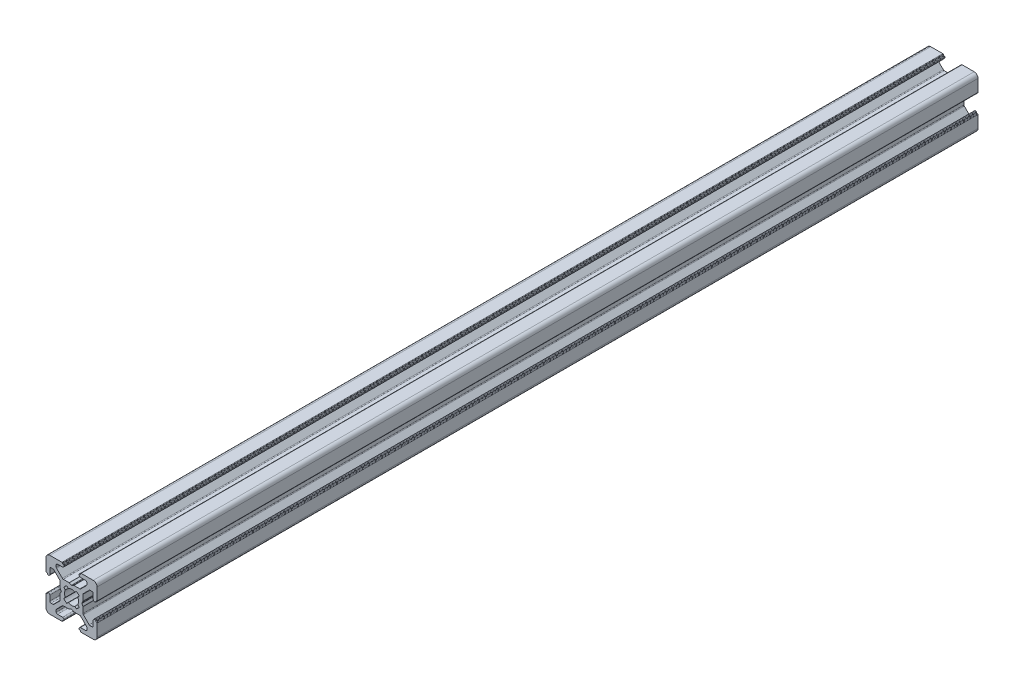
from build123d import *

# Parameters (mm, degrees)
EXTRUDE1_DEPTH = 345


with BuildPart() as part:
    # Sketch1 → Extrude1 (new body)
    with BuildSketch(Plane.XY):
        with BuildLine():
            Line((-3.5, 8.499999673), (-5.500000686, 8.499999673))
            ThreePointArc((-5.500000686, 8.499999673), (-5.853554077, 8.353553064), (-6.000000686, 7.999999673))
            Line((-6.000000686, 7.999999673), (-6.000000686, 7.267766626))
            ThreePointArc((-6.000000686, 7.267766626), (-5.961940448, 7.076424899), (-5.853554059, 6.914213219))
            Line((-5.853554059, 6.914213219), (-3.585787212, 4.646446592))
            ThreePointArc((-3.585787212, 4.646446592), (-3.423575544, 4.538060229), (-3.232233839, 4.5))
            Line((-3.232233839, 4.5), (-0.953590312, 4.5))
            ThreePointArc((-0.953590312, 4.5), (-0.901826505, 4.493185166), (-0.853590316, 4.473205083))
            Line((-0.853590316, 4.473205083), (-0.100000045, 4.038119562))
            ThreePointArc((-0.100000045, 4.038119562), (0, 4.011324632), (0.100000045, 4.038119562))
            Line((0.100000045, 4.038119562), (0.853590316, 4.473205083))
            ThreePointArc((0.853590316, 4.473205083), (0.901826505, 4.493185166), (0.953590312, 4.5))
            Line((0.953590312, 4.5), (3.232233839, 4.5))
            ThreePointArc((3.232233839, 4.5), (3.423575544, 4.538060229), (3.585787212, 4.646446592))
            Line((3.585787212, 4.646446592), (5.853554059, 6.914213219))
            ThreePointArc((5.853554059, 6.914213219), (5.961940448, 7.076424899), (6.000000686, 7.267766626))
            Line((6.000000686, 7.267766626), (6.000000686, 7.999999673))
            ThreePointArc((6.000000686, 7.999999673), (5.853554077, 8.353553064), (5.500000686, 8.499999673))
            Line((5.500000686, 8.499999673), (3.5, 8.499999673))
            ThreePointArc((3.5, 8.499999673), (3.146446609, 8.646446283), (3, 8.999999673))
            Line((3, 8.999999673), (3, 9.3))
            ThreePointArc((3, 9.3), (3.058578644, 9.441421356), (3.2, 9.5))
            Line((3.2, 9.5), (3.350000228, 9.5))
            ThreePointArc((3.350000228, 9.5), (3.491421584, 9.558578644), (3.550000228, 9.7))
            Line((3.550000228, 9.7), (3.550000228, 9.8))
            ThreePointArc((3.550000228, 9.8), (3.608578871, 9.941421356), (3.750000228, 10))
            Line((3.750000228, 10), (8.5, 10))
            ThreePointArc((8.5, 10), (9.560660172, 9.560660172), (10, 8.5))
            Line((10, 8.5), (10, 3.749999605))
            ThreePointArc((10, 3.749999605), (9.941421356, 3.608578248), (9.8, 3.549999605))
            Line((9.8, 3.549999605), (9.699999732, 3.549999605))
            ThreePointArc((9.699999732, 3.549999605), (9.558578376, 3.491420961), (9.499999732, 3.349999605))
            Line((9.499999732, 3.349999605), (9.499999732, 3.2))
            ThreePointArc((9.499999732, 3.2), (9.441421088, 3.058578644), (9.299999732, 3))
            Line((9.299999732, 3), (8.999999732, 3))
            ThreePointArc((8.999999732, 3), (8.646446341, 3.146446609), (8.499999732, 3.5))
            Line((8.499999732, 3.5), (8.499999732, 5.499999605))
            ThreePointArc((8.499999732, 5.499999605), (8.353553123, 5.853552995), (7.999999732, 5.999999605))
            Line((7.999999732, 5.999999605), (7.267766685, 5.999999605))
            ThreePointArc((7.267766685, 5.999999605), (7.076424969, 5.961939371), (6.914213294, 5.853552995))
            Line((6.914213294, 5.853552995), (4.646446398, 3.585786099))
            ThreePointArc((4.646446398, 3.585786099), (4.538060023, 3.423574425), (4.499999789, 3.232232708))
            Line((4.499999789, 3.232232708), (4.499999789, 0.953589302))
            ThreePointArc((4.499999789, 0.953589302), (4.493184953, 0.90182549), (4.473204867, 0.853589297))
            Line((4.473204867, 0.853589297), (4.038119841, 0.099999969))
            ThreePointArc((4.038119841, 0.099999969), (4.011324929, 0), (4.038119841, -0.099999969))
            Line((4.038119841, -0.099999969), (4.473204867, -0.853589297))
            ThreePointArc((4.473204867, -0.853589297), (4.493184953, -0.90182549), (4.499999789, -0.953589302))
            Line((4.499999789, -0.953589302), (4.499999789, -3.232232708))
            ThreePointArc((4.499999789, -3.232232708), (4.538060023, -3.423574425), (4.646446398, -3.585786099))
            Line((4.646446398, -3.585786099), (6.914213294, -5.853552995))
            ThreePointArc((6.914213294, -5.853552995), (7.076424969, -5.961939371), (7.267766685, -5.999999605))
            Line((7.267766685, -5.999999605), (7.999999732, -5.999999605))
            ThreePointArc((7.999999732, -5.999999605), (8.353553123, -5.853552995), (8.499999732, -5.499999605))
            Line((8.499999732, -5.499999605), (8.499999732, -3.5))
            ThreePointArc((8.499999732, -3.5), (8.646446341, -3.146446609), (8.999999732, -3))
            Line((8.999999732, -3), (9.299999732, -3))
            ThreePointArc((9.299999732, -3), (9.441421088, -3.058578644), (9.499999732, -3.2))
            Line((9.499999732, -3.2), (9.499999732, -3.349999605))
            ThreePointArc((9.499999732, -3.349999605), (9.558578376, -3.491420961), (9.699999732, -3.549999605))
            Line((9.699999732, -3.549999605), (9.8, -3.549999605))
            ThreePointArc((9.8, -3.549999605), (9.941421356, -3.608578248), (10, -3.749999605))
            Line((10, -3.749999605), (10, -8.5))
            ThreePointArc((10, -8.5), (9.560660172, -9.560660172), (8.5, -10))
            Line((8.5, -10), (3.750000228, -10))
            ThreePointArc((3.750000228, -10), (3.608578871, -9.941421356), (3.550000228, -9.8))
            Line((3.550000228, -9.8), (3.550000228, -9.7))
            ThreePointArc((3.550000228, -9.7), (3.491421584, -9.558578644), (3.350000228, -9.5))
            Line((3.350000228, -9.5), (3.2, -9.5))
            ThreePointArc((3.2, -9.5), (3.058578644, -9.441421356), (3, -9.3))
            Line((3, -9.3), (3, -8.999999673))
            ThreePointArc((3, -8.999999673), (3.146446609, -8.646446283), (3.5, -8.499999673))
            Line((3.5, -8.499999673), (5.500000686, -8.499999673))
            ThreePointArc((5.500000686, -8.499999673), (5.853554077, -8.353553064), (6.000000686, -7.999999673))
            Line((6.000000686, -7.999999673), (6.000000686, -7.267766626))
            ThreePointArc((6.000000686, -7.267766626), (5.961940448, -7.076424899), (5.853554059, -6.914213219))
            Line((5.853554059, -6.914213219), (3.585787212, -4.646446592))
            ThreePointArc((3.585787212, -4.646446592), (3.423575544, -4.538060229), (3.232233839, -4.5))
            Line((3.232233839, -4.5), (0.953590312, -4.5))
            ThreePointArc((0.953590312, -4.5), (0.901826505, -4.493185166), (0.853590316, -4.473205083))
            Line((0.853590316, -4.473205083), (0.100000045, -4.038119562))
            ThreePointArc((0.100000045, -4.038119562), (0, -4.011324632), (-0.100000045, -4.038119562))
            Line((-0.100000045, -4.038119562), (-0.853590316, -4.473205083))
            ThreePointArc((-0.853590316, -4.473205083), (-0.901826505, -4.493185166), (-0.953590312, -4.5))
            Line((-0.953590312, -4.5), (-3.232233839, -4.5))
            ThreePointArc((-3.232233839, -4.5), (-3.423575544, -4.538060229), (-3.585787212, -4.646446592))
            Line((-3.585787212, -4.646446592), (-5.853554059, -6.914213219))
            ThreePointArc((-5.853554059, -6.914213219), (-5.961940448, -7.076424899), (-6.000000686, -7.267766626))
            Line((-6.000000686, -7.267766626), (-6.000000686, -7.999999673))
            ThreePointArc((-6.000000686, -7.999999673), (-5.853554077, -8.353553064), (-5.500000686, -8.499999673))
            Line((-5.500000686, -8.499999673), (-3.5, -8.499999673))
            ThreePointArc((-3.5, -8.499999673), (-3.146446609, -8.646446283), (-3, -8.999999673))
            Line((-3, -8.999999673), (-3, -9.3))
            ThreePointArc((-3, -9.3), (-3.058578644, -9.441421356), (-3.2, -9.5))
            Line((-3.2, -9.5), (-3.350000228, -9.5))
            ThreePointArc((-3.350000228, -9.5), (-3.491421584, -9.558578644), (-3.550000228, -9.7))
            Line((-3.550000228, -9.7), (-3.550000228, -9.8))
            ThreePointArc((-3.550000228, -9.8), (-3.608578871, -9.941421356), (-3.750000228, -10))
            Line((-3.750000228, -10), (-8.5, -10))
            ThreePointArc((-8.5, -10), (-9.560660172, -9.560660172), (-10, -8.5))
            Line((-10, -8.5), (-10, -3.749999605))
            ThreePointArc((-10, -3.749999605), (-9.941421356, -3.608578248), (-9.8, -3.549999605))
            Line((-9.8, -3.549999605), (-9.699999732, -3.549999605))
            ThreePointArc((-9.699999732, -3.549999605), (-9.558578376, -3.491420961), (-9.499999732, -3.349999605))
            Line((-9.499999732, -3.349999605), (-9.499999732, -3.2))
            ThreePointArc((-9.499999732, -3.2), (-9.441421088, -3.058578644), (-9.299999732, -3))
            Line((-9.299999732, -3), (-8.999999732, -3))
            ThreePointArc((-8.999999732, -3), (-8.646446341, -3.146446609), (-8.499999732, -3.5))
            Line((-8.499999732, -3.5), (-8.499999732, -5.499999605))
            ThreePointArc((-8.499999732, -5.499999605), (-8.353553123, -5.853552995), (-7.999999732, -5.999999605))
            Line((-7.999999732, -5.999999605), (-7.267766685, -5.999999605))
            ThreePointArc((-7.267766685, -5.999999605), (-7.076424969, -5.961939371), (-6.914213294, -5.853552995))
            Line((-6.914213294, -5.853552995), (-4.646446398, -3.585786099))
            ThreePointArc((-4.646446398, -3.585786099), (-4.538060023, -3.423574425), (-4.499999789, -3.232232708))
            Line((-4.499999789, -3.232232708), (-4.499999789, -0.953589302))
            ThreePointArc((-4.499999789, -0.953589302), (-4.493184953, -0.90182549), (-4.473204867, -0.853589297))
            Line((-4.473204867, -0.853589297), (-4.038119841, -0.099999969))
            ThreePointArc((-4.038119841, -0.099999969), (-4.011324929, 0), (-4.038119841, 0.099999969))
            Line((-4.038119841, 0.099999969), (-4.473204867, 0.853589297))
            ThreePointArc((-4.473204867, 0.853589297), (-4.493184953, 0.90182549), (-4.499999789, 0.953589302))
            Line((-4.499999789, 0.953589302), (-4.499999789, 3.232232708))
            ThreePointArc((-4.499999789, 3.232232708), (-4.538060023, 3.423574425), (-4.646446398, 3.585786099))
            Line((-4.646446398, 3.585786099), (-6.914213294, 5.853552995))
            ThreePointArc((-6.914213294, 5.853552995), (-7.076424969, 5.961939371), (-7.267766685, 5.999999605))
            Line((-7.267766685, 5.999999605), (-7.999999732, 5.999999605))
            ThreePointArc((-7.999999732, 5.999999605), (-8.353553123, 5.853552995), (-8.499999732, 5.499999605))
            Line((-8.499999732, 5.499999605), (-8.499999732, 3.5))
            ThreePointArc((-8.499999732, 3.5), (-8.646446341, 3.146446609), (-8.999999732, 3))
            Line((-8.999999732, 3), (-9.299999732, 3))
            ThreePointArc((-9.299999732, 3), (-9.441421088, 3.058578644), (-9.499999732, 3.2))
            Line((-9.499999732, 3.2), (-9.499999732, 3.349999605))
            ThreePointArc((-9.499999732, 3.349999605), (-9.558578376, 3.491420961), (-9.699999732, 3.549999605))
            Line((-9.699999732, 3.549999605), (-9.8, 3.549999605))
            ThreePointArc((-9.8, 3.549999605), (-9.941421356, 3.608578248), (-10, 3.749999605))
            Line((-10, 3.749999605), (-10, 8.5))
            ThreePointArc((-10, 8.5), (-9.560660172, 9.560660172), (-8.5, 10))
            Line((-8.5, 10), (-3.750000228, 10))
            ThreePointArc((-3.750000228, 10), (-3.608578871, 9.941421356), (-3.550000228, 9.8))
            Line((-3.550000228, 9.8), (-3.550000228, 9.7))
            ThreePointArc((-3.550000228, 9.7), (-3.491421584, 9.558578644), (-3.350000228, 9.5))
            Line((-3.350000228, 9.5), (-3.2, 9.5))
            ThreePointArc((-3.2, 9.5), (-3.058578644, 9.441421356), (-3, 9.3))
            Line((-3, 9.3), (-3, 8.999999673))
            ThreePointArc((-3, 8.999999673), (-3.146446609, 8.646446283), (-3.5, 8.499999673))
        make_face()
        with BuildLine():
            Line((-1.258185436, 2.445295362), (-1.91389502, 2.989640962))
            ThreePointArc((-1.91389502, 2.989640962), (-2.511737261, 2.508410485), (-2.992174953, 1.909930962))
            Line((-2.992174953, 1.909930962), (-2.445295423, 1.258185317))
            ThreePointArc((-2.445295423, 1.258185317), (-2.75, 0), (-2.445295423, -1.258185317))
            Line((-2.445295423, -1.258185317), (-2.992174953, -1.909930962))
            ThreePointArc((-2.992174953, -1.909930962), (-2.511737261, -2.508410485), (-1.91389502, -2.989640962))
            Line((-1.91389502, -2.989640962), (-1.258185436, -2.445295362))
            ThreePointArc((-1.258185436, -2.445295362), (0, -2.75), (1.258185436, -2.445295362))
            Line((1.258185436, -2.445295362), (1.91389502, -2.989640962))
            ThreePointArc((1.91389502, -2.989640962), (2.511737261, -2.508410485), (2.992174953, -1.909930962))
            Line((2.992174953, -1.909930962), (2.445295423, -1.258185317))
            ThreePointArc((2.445295423, -1.258185317), (2.75, 0), (2.445295423, 1.258185317))
            Line((2.445295423, 1.258185317), (2.992174953, 1.909930962))
            ThreePointArc((2.992174953, 1.909930962), (2.511737261, 2.508410485), (1.91389502, 2.989640962))
            Line((1.91389502, 2.989640962), (1.258185436, 2.445295362))
            ThreePointArc((1.258185436, 2.445295362), (0, 2.75), (-1.258185436, 2.445295362))
        make_face(mode=Mode.SUBTRACT)
    extrude(amount=EXTRUDE1_DEPTH)


solid = part.part
